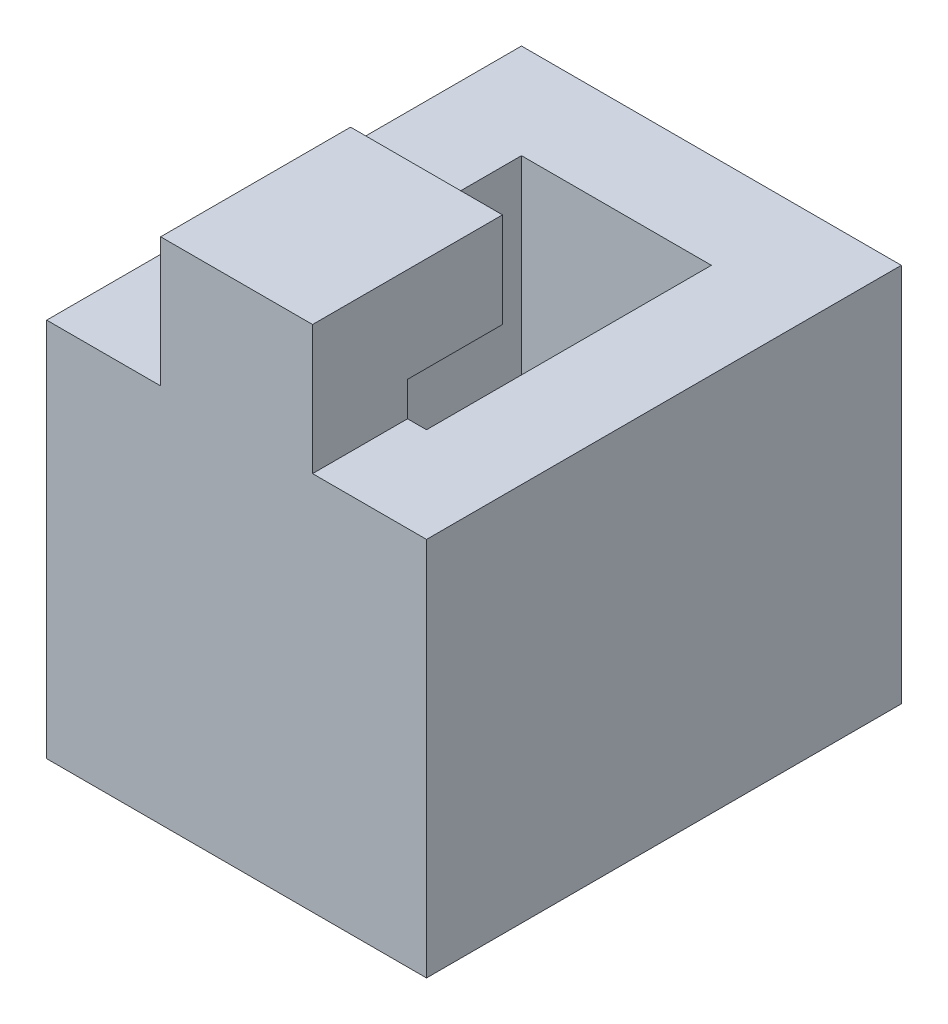
from build123d import *

# Parameters (mm, degrees)
SKETCH1_W                  = 20
SKETCH1_H                  = 20
BOSS_EXTRUDE1_DEPTH        = 5
F_4_0_209_DIAMETER_HOLE1_D = 5.3086
BOSS_EXTRUDE5_START        = 5
SKETCH1_5_W                = 5
SKETCH1_5_H                = 20
BOSS_EXTRUDE5_DEPTH        = 15
BOSS_EXTRUDE6_START        = 20
SKETCH1_6_W                = 5
SKETCH1_6_H                = 20
BOSS_EXTRUDE6_DEPTH        = 5
BOSS_EXTRUDE7_START        = 25
SKETCH1_7_W                = 8
SKETCH1_7_H                = 1.8
BOSS_EXTRUDE7_DEPTH        = 5
BOSS_EXTRUDE8_START        = 25
SKETCH1_8_W                = 8
SKETCH1_8_H                = 5
BOSS_EXTRUDE8_DEPTH        = 10


with BuildPart() as part:
    # Sketch1 → Boss-Extrude1 (new body)
    with BuildSketch(Plane.XY):
        Rectangle(SKETCH1_W, SKETCH1_H)
    extrude(amount=BOSS_EXTRUDE1_DEPTH)

    # #4 (0.209) Diameter Hole1 (through all)
    with Locations(Plane.XY.offset(5)):
        with Locations((0, 0)):
            Hole(F_4_0_209_DIAMETER_HOLE1_D / 2)

    # Sketch1<5> → Boss-Extrude5 (add)
    with BuildSketch(Plane.XY.offset(BOSS_EXTRUDE5_START)):
        with Locations((-7.5, 0)):
            Rectangle(SKETCH1_5_W, SKETCH1_5_H)
        with Locations((7.5, 0)):
            Rectangle(SKETCH1_5_W, SKETCH1_5_H)
    extrude(amount=BOSS_EXTRUDE5_DEPTH)

    # Sketch1<6> → Boss-Extrude6 (add)
    with BuildSketch(Plane.XY.offset(BOSS_EXTRUDE6_START)):
        with Locations((-7.5, 0)):
            Rectangle(SKETCH1_6_W, SKETCH1_6_H)
        Polygon((4, 10), (-4, 10), (-5, 10), (-5, -10), (5, -10), (5, 10), align=None)
        with Locations((7.5, 0)):
            Rectangle(SKETCH1_6_W, SKETCH1_6_H)
    extrude(amount=BOSS_EXTRUDE6_DEPTH)

    # Sketch1<7> → Boss-Extrude7 (add)
    with BuildSketch(Plane.XY.offset(BOSS_EXTRUDE7_START)):
        with Locations((0, 10.9)):
            Rectangle(SKETCH1_7_W, SKETCH1_7_H)
    extrude(amount=-BOSS_EXTRUDE7_DEPTH)

    # Sketch1<8> → Boss-Extrude8 (add)
    with BuildSketch(Plane.XY.offset(BOSS_EXTRUDE8_START)):
        with Locations((0, 14.3)):
            Rectangle(SKETCH1_8_W, SKETCH1_8_H)
    extrude(amount=-BOSS_EXTRUDE8_DEPTH)


solid = part.part
